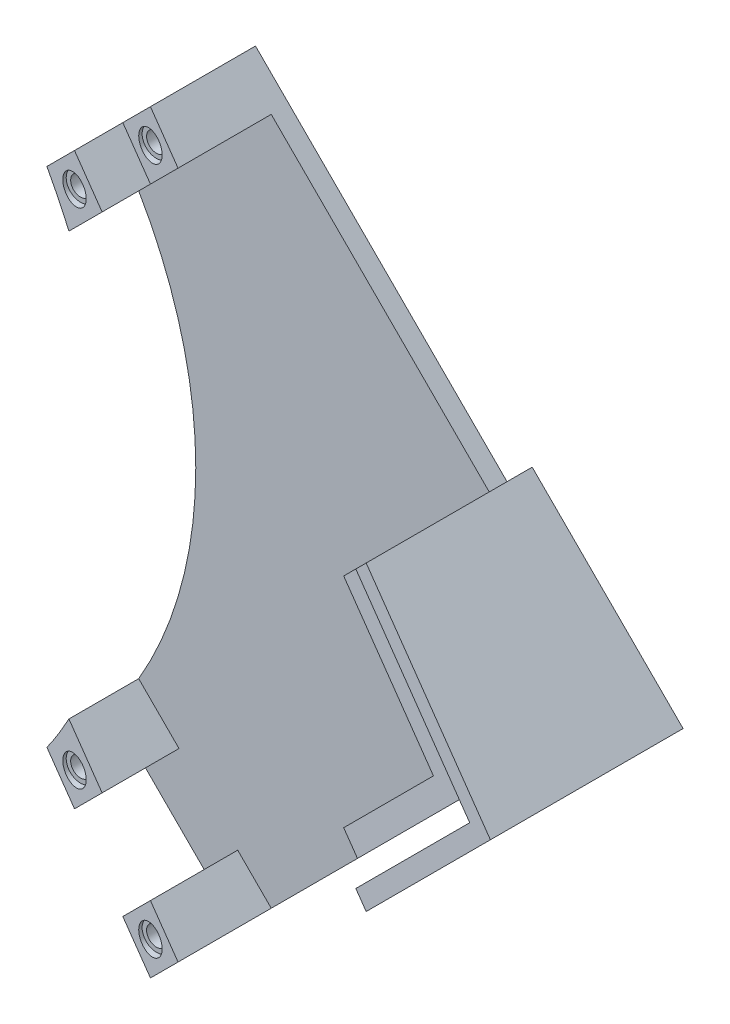
from build123d import *

# Parameters (mm, degrees)
CLOSED_BOTTOM_PLATE_3MM_DEPTH       = 3
FOOT1_CURVED_R70P71_DEPTH           = 33
FOOT2_CURVED_R70P71_DEPTH           = 33
PAD4_C_BLANK_DEPTH                  = 33
PAD5_A_BLANK_DEPTH                  = 33
SLOT_BACKING_INSIDE_NORTH_DEPTH     = 35
SLOT_BACKING_INSIDE_EAST_DEPTH      = 35
TOP_OUTER_PLANE_DEPTH               = 159.981130956
TOP_OUTER_PLANE_DEPTH_BACK          = 159.981130956
SLOT_BASE_NORTH_DEPTH               = 3
SLOT_BASE_EAST_DEPTH                = 3
SLOT_OUTER_NORTH_DEPTH              = 35
SLOT_OUTER_EAST_DEPTH               = 35
CUT_EXTRUDE_2_DEPTH                 = 167.574307743
CUT_EXTRUDE_2_DEPTH_BACK            = 167.574307743
LOCATOR_1_SOCKET_D3P3_START         = 9.968990399
LOCATOR_1_SOCKET_D3P3_SKETCH_R      = 1.65
LOCATOR_1_SOCKET_D3P3_DEPTH         = 7
LOCATOR_1_ROOT_RELIEF_D4P8_START    = 13.968990399
LOCATOR_1_ROOT_RELIEF_D4P8_SKETCH_R = 2.4
LOCATOR_1_ROOT_RELIEF_D4P8_DEPTH    = 3
LOCATOR_2_SOCKET_D3P3_START         = 9.968990399
LOCATOR_2_SOCKET_D3P3_SKETCH_R      = 1.65
LOCATOR_2_SOCKET_D3P3_DEPTH         = 7
LOCATOR_2_ROOT_RELIEF_D4P8_START    = 13.968990399
LOCATOR_2_ROOT_RELIEF_D4P8_SKETCH_R = 2.4
LOCATOR_2_ROOT_RELIEF_D4P8_DEPTH    = 3
LOCATOR_3_SOCKET_D3P3_START         = 12.718990399
LOCATOR_3_SOCKET_D3P3_SKETCH_R      = 1.65
LOCATOR_3_SOCKET_D3P3_DEPTH         = 7
LOCATOR_3_ROOT_RELIEF_D4P8_START    = 16.718990399
LOCATOR_3_ROOT_RELIEF_D4P8_SKETCH_R = 2.4
LOCATOR_3_ROOT_RELIEF_D4P8_DEPTH    = 3
LOCATOR_4_SOCKET_D3P3_START         = 12.718990399
LOCATOR_4_SOCKET_D3P3_SKETCH_R      = 1.65
LOCATOR_4_SOCKET_D3P3_DEPTH         = 7
LOCATOR_4_ROOT_RELIEF_D4P8_START    = 16.718990399
LOCATOR_4_ROOT_RELIEF_D4P8_SKETCH_R = 2.4
LOCATOR_4_ROOT_RELIEF_D4P8_DEPTH    = 3


with BuildPart() as part:
    # Closed_bottom_plate_3mm_sketch → Closed_bottom_plate_3mm (new body)
    with BuildSketch(Plane.XY):
        with BuildLine():
            Line((77.781745931, -63.639610307), (141.421356237, 0))
            Line((141.421356237, 0), (77.781745931, 63.639610307))
            Line((77.781745931, 63.639610307), (56.568542495, 42.426406871))
            ThreePointArc((56.568542495, 42.426406871), (70.710678119, 0), (56.568542495, -42.426406871))
            Line((56.568542495, -42.426406871), (77.781745931, -63.639610307))
        make_face()
    extrude(amount=CLOSED_BOTTOM_PLATE_3MM_DEPTH)

    # Foot1_curved_R70p71_sketch → Foot1_curved_R70p71 (add)
    with BuildSketch(Plane.XY):
        with BuildLine():
            Line((62.225396744, 48.083261121), (67.882250994, 42.426406871))
            Line((67.882250994, 42.426406871), (61.080791676, 35.624947554))
            ThreePointArc((61.080791676, 35.624947554), (58.922885367, 39.090837546), (56.568542495, 42.426406871))
            Line((56.568542495, 42.426406871), (62.225396744, 48.083261121))
        make_face()
    extrude(amount=FOOT1_CURVED_R70P71_DEPTH)

    # Foot2_curved_R70p71_sketch → Foot2_curved_R70p71 (add)
    with BuildSketch(Plane.XY):
        with BuildLine():
            Line((62.225396744, -48.083261121), (67.882250994, -42.426406871))
            Line((67.882250994, -42.426406871), (61.080791676, -35.624947554))
            ThreePointArc((61.080791676, -35.624947554), (58.922885367, -39.090837546), (56.568542495, -42.426406871))
            Line((56.568542495, -42.426406871), (62.225396744, -48.083261121))
        make_face()
    extrude(amount=FOOT2_CURVED_R70P71_DEPTH)

    # Pad4_C_blank_sketch → Pad4_C_blank (add)
    with BuildSketch(Plane.XY):
        Polygon((72.124891681, 57.982756057), (77.781745931, 52.325901808), (83.43860018, 57.982756057), (77.781745931, 63.639610307), align=None)
    extrude(amount=PAD4_C_BLANK_DEPTH)

    # Pad5_A_blank_sketch → Pad5_A_blank (add)
    with BuildSketch(Plane.XY):
        Polygon((72.124891681, -57.982756057), (77.781745931, -63.639610307), (83.43860018, -57.982756057), (77.781745931, -52.325901808), align=None)
    extrude(amount=PAD5_A_BLANK_DEPTH)

    # Slot_backing_inside_north_sketch → Slot_backing_inside_north (add)
    with BuildSketch(Plane.XY):
        Polygon((117.379725677, 18.384776311), (138.592929113, -2.828427125), (141.421356237, 0), (120.208152802, 21.213203436), align=None)
    extrude(amount=SLOT_BACKING_INSIDE_NORTH_DEPTH)

    # Slot_backing_inside_east_sketch → Slot_backing_inside_east (add)
    with BuildSketch(Plane.XY):
        Polygon((117.379725677, -18.384776311), (120.208152802, -21.213203436), (141.421356237, 0), (138.592929113, 2.828427125), align=None)
    extrude(amount=SLOT_BACKING_INSIDE_EAST_DEPTH)

    # Top_outer_plane_sketch → Top_outer_plane (cut, two sides: drawn at the far end of the back side and taken through both)
    with BuildSketch(Plane(origin=(0, 0, 0), x_dir=(1, 0, 0), z_dir=(0, 1, 0)).offset(-TOP_OUTER_PLANE_DEPTH_BACK)):
        Polygon((-100, 13.708679131), (250, -48.163164223), (250, -100), (-100, -100), align=None)
    extrude(amount=TOP_OUTER_PLANE_DEPTH + TOP_OUTER_PLANE_DEPTH_BACK, mode=Mode.SUBTRACT)

    # Slot_base_north_sketch → Slot_base_north (add)
    with BuildSketch(Plane.XY):
        Polygon((117.379725677, 18.384776311), (142.8355698, -7.071067812), (149.906637612, 0), (124.450793489, 25.455844123), align=None)
    extrude(amount=SLOT_BASE_NORTH_DEPTH)

    # Slot_base_east_sketch → Slot_base_east (add)
    with BuildSketch(Plane.XY):
        Polygon((117.379725677, -18.384776311), (124.450793489, -25.455844123), (149.906637612, 0), (142.8355698, 7.071067812), align=None)
    extrude(amount=SLOT_BASE_EAST_DEPTH)

    # Slot_outer_north_sketch → Slot_outer_north (add)
    with BuildSketch(Plane.XY):
        Polygon((122.329473145, 23.334523779), (147.785317268, -2.121320344), (149.906637612, 0), (124.450793489, 25.455844123), align=None)
    extrude(amount=SLOT_OUTER_NORTH_DEPTH)

    # Slot_outer_east_sketch → Slot_outer_east (add)
    with BuildSketch(Plane.XY):
        Polygon((122.329473145, -23.334523779), (124.450793489, -25.455844123), (149.906637612, 0), (147.785317268, 2.121320344), align=None)
    extrude(amount=SLOT_OUTER_EAST_DEPTH)

    # 草图13 → 切除-拉伸2 (cut, two sides: drawn at the far end of the back side and taken through both)
    with BuildSketch(Plane(origin=(0, 0, 0), x_dir=(1, 0, 0), z_dir=(0, 1, 0)).offset(-CUT_EXTRUDE_2_DEPTH_BACK)):
        Polygon((-100, 11.67766953), (250, -50.194173824), (250, -100), (-100, -100), align=None)
    extrude(amount=CUT_EXTRUDE_2_DEPTH + CUT_EXTRUDE_2_DEPTH_BACK, mode=Mode.SUBTRACT)

    # Locator_1_socket_D3p3_sketch → Locator_1_socket_D3p3 (cut)
    with BuildSketch(Plane.XY.offset(LOCATOR_1_SOCKET_D3P3_START)):
        with Locations(Location((62.225396744, 42.426406871, 0), (0, 0, 180))):
            Circle(LOCATOR_1_SOCKET_D3P3_SKETCH_R)
    extrude(amount=LOCATOR_1_SOCKET_D3P3_DEPTH, mode=Mode.SUBTRACT)

    # Locator_1_root_relief_D4p8_sketch → Locator_1_root_relief_D4p8 (cut)
    with BuildSketch(Plane.XY.offset(LOCATOR_1_ROOT_RELIEF_D4P8_START)):
        with Locations(Location((62.225396744, 42.426406871, 0), (0, 0, 180))):
            Circle(LOCATOR_1_ROOT_RELIEF_D4P8_SKETCH_R)
    extrude(amount=LOCATOR_1_ROOT_RELIEF_D4P8_DEPTH, mode=Mode.SUBTRACT)

    # Locator_2_socket_D3p3_sketch → Locator_2_socket_D3p3 (cut)
    with BuildSketch(Plane.XY.offset(LOCATOR_2_SOCKET_D3P3_START)):
        with Locations(Location((62.225396744, -42.426406871, 0), (0, 0, 180))):
            Circle(LOCATOR_2_SOCKET_D3P3_SKETCH_R)
    extrude(amount=LOCATOR_2_SOCKET_D3P3_DEPTH, mode=Mode.SUBTRACT)

    # Locator_2_root_relief_D4p8_sketch → Locator_2_root_relief_D4p8 (cut)
    with BuildSketch(Plane.XY.offset(LOCATOR_2_ROOT_RELIEF_D4P8_START)):
        with Locations(Location((62.225396744, -42.426406871, 0), (0, 0, 180))):
            Circle(LOCATOR_2_ROOT_RELIEF_D4P8_SKETCH_R)
    extrude(amount=LOCATOR_2_ROOT_RELIEF_D4P8_DEPTH, mode=Mode.SUBTRACT)

    # Locator_3_socket_D3p3_sketch → Locator_3_socket_D3p3 (cut)
    with BuildSketch(Plane.XY.offset(LOCATOR_3_SOCKET_D3P3_START)):
        with Locations(Location((77.781745931, 57.982756057, 0), (0, 0, 180))):
            Circle(LOCATOR_3_SOCKET_D3P3_SKETCH_R)
    extrude(amount=LOCATOR_3_SOCKET_D3P3_DEPTH, mode=Mode.SUBTRACT)

    # Locator_3_root_relief_D4p8_sketch → Locator_3_root_relief_D4p8 (cut)
    with BuildSketch(Plane.XY.offset(LOCATOR_3_ROOT_RELIEF_D4P8_START)):
        with Locations(Location((77.781745931, 57.982756057, 0), (0, 0, 180))):
            Circle(LOCATOR_3_ROOT_RELIEF_D4P8_SKETCH_R)
    extrude(amount=LOCATOR_3_ROOT_RELIEF_D4P8_DEPTH, mode=Mode.SUBTRACT)

    # Locator_4_socket_D3p3_sketch → Locator_4_socket_D3p3 (cut)
    with BuildSketch(Plane.XY.offset(LOCATOR_4_SOCKET_D3P3_START)):
        with Locations(Location((77.781745931, -57.982756057, 0), (0, 0, 180))):
            Circle(LOCATOR_4_SOCKET_D3P3_SKETCH_R)
    extrude(amount=LOCATOR_4_SOCKET_D3P3_DEPTH, mode=Mode.SUBTRACT)

    # Locator_4_root_relief_D4p8_sketch → Locator_4_root_relief_D4p8 (cut)
    with BuildSketch(Plane.XY.offset(LOCATOR_4_ROOT_RELIEF_D4P8_START)):
        with Locations(Location((77.781745931, -57.982756057, 0), (0, 0, 180))):
            Circle(LOCATOR_4_ROOT_RELIEF_D4P8_SKETCH_R)
    extrude(amount=LOCATOR_4_ROOT_RELIEF_D4P8_DEPTH, mode=Mode.SUBTRACT)


solid = part.part
